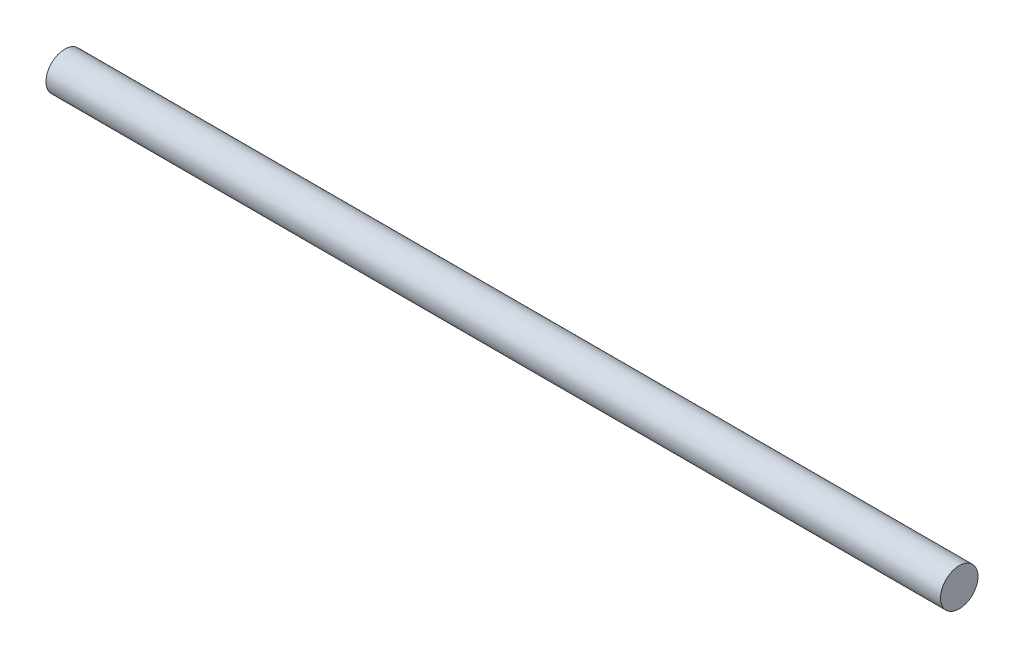
from build123d import *

# Parameters (mm, degrees)
CROQUIS1_R              = 6.5
SALIENTE_EXTRUIR1_DEPTH = 310


with BuildPart() as part:
    # Croquis1 → Saliente-Extruir1 (new body)
    with BuildSketch(Plane(origin=(0, 0, 0), x_dir=(0, 0, -1), z_dir=(1, 0, 0))):
        Circle(CROQUIS1_R)
    extrude(amount=SALIENTE_EXTRUIR1_DEPTH)


solid = part.part
